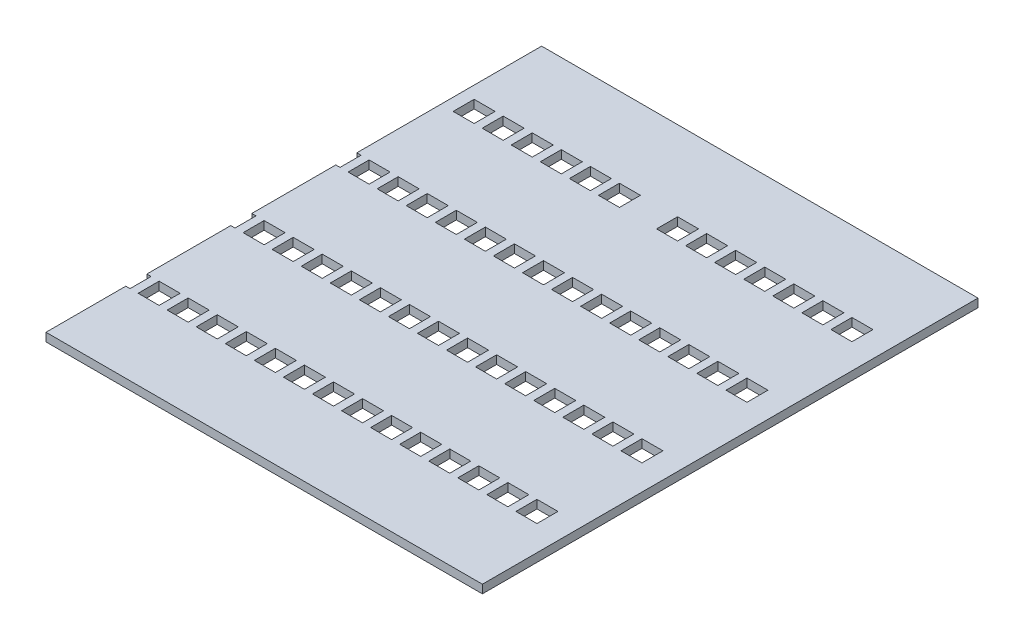
from build123d import *

# Parameters (mm, degrees)
SKETCH3_W           = 5
SKETCH3_H           = 5
BOSS_EXTRUDE1_DEPTH = 2


with BuildPart() as part:
    # Sketch3 → Boss-Extrude1 (new body)
    with BuildSketch(Plane(origin=(0, 0, 0), x_dir=(1, 0, 0), z_dir=(0, 1, 0))):
        Polygon((43.186764706, 63.988970588), (-60.713235294, 63.988970588), (-60.713235294, 19.988970588), (-59.703235294, 19.988970588), (-59.703235294, 14.988970588), (-60.713235294, 14.988970588), (-60.713235294, -5.011029412), (-59.703235294, -5.011029412), (-59.703235294, -10.011029412), (-60.713235294, -10.011029412), (-60.713235294, -30.011029412), (-59.703235294, -30.011029412), (-59.703235294, -35.011029412), (-60.713235294, -35.011029412), (-60.713235294, -54.011029412), (43.186764706, -54.011029412), align=None)
        with Locations((-55.283235294, -32.511029412)):
            Rectangle(SKETCH3_W, SKETCH3_H, mode=Mode.SUBTRACT)
        with Locations((-48.363235294, -32.511029412)):
            Rectangle(SKETCH3_W, SKETCH3_H, mode=Mode.SUBTRACT)
        with Locations((-41.443235294, -32.511029412)):
            Rectangle(SKETCH3_W, SKETCH3_H, mode=Mode.SUBTRACT)
        with Locations((-34.523235294, -32.511029412)):
            Rectangle(SKETCH3_W, SKETCH3_H, mode=Mode.SUBTRACT)
        with Locations((-27.603235294, -32.511029412)):
            Rectangle(SKETCH3_W, SKETCH3_H, mode=Mode.SUBTRACT)
        with Locations((-20.683235294, -32.511029412)):
            Rectangle(SKETCH3_W, SKETCH3_H, mode=Mode.SUBTRACT)
        with Locations((-13.763235294, -32.511029412)):
            Rectangle(SKETCH3_W, SKETCH3_H, mode=Mode.SUBTRACT)
        with Locations((-55.283235294, -7.511029412)):
            Rectangle(SKETCH3_W, SKETCH3_H, mode=Mode.SUBTRACT)
        with Locations((-48.363235294, -7.511029412)):
            Rectangle(SKETCH3_W, SKETCH3_H, mode=Mode.SUBTRACT)
        with Locations((-41.443235294, -7.511029412)):
            Rectangle(SKETCH3_W, SKETCH3_H, mode=Mode.SUBTRACT)
        with Locations((-34.523235294, -7.511029412)):
            Rectangle(SKETCH3_W, SKETCH3_H, mode=Mode.SUBTRACT)
        with Locations((-27.603235294, -7.511029412)):
            Rectangle(SKETCH3_W, SKETCH3_H, mode=Mode.SUBTRACT)
        with Locations((-20.683235294, -7.511029412)):
            Rectangle(SKETCH3_W, SKETCH3_H, mode=Mode.SUBTRACT)
        with Locations((-13.763235294, -7.511029412)):
            Rectangle(SKETCH3_W, SKETCH3_H, mode=Mode.SUBTRACT)
        with Locations((-6.843235294, -32.511029412)):
            Rectangle(SKETCH3_W, SKETCH3_H, mode=Mode.SUBTRACT)
        with Locations((0.076764706, -32.511029412)):
            Rectangle(SKETCH3_W, SKETCH3_H, mode=Mode.SUBTRACT)
        with Locations((6.996764706, -32.511029412)):
            Rectangle(SKETCH3_W, SKETCH3_H, mode=Mode.SUBTRACT)
        with Locations((13.916764706, -32.511029412)):
            Rectangle(SKETCH3_W, SKETCH3_H, mode=Mode.SUBTRACT)
        with Locations((20.836764706, -32.511029412)):
            Rectangle(SKETCH3_W, SKETCH3_H, mode=Mode.SUBTRACT)
        with Locations((27.756764706, -32.511029412)):
            Rectangle(SKETCH3_W, SKETCH3_H, mode=Mode.SUBTRACT)
        with Locations((34.676764706, -32.511029412)):
            Rectangle(SKETCH3_W, SKETCH3_H, mode=Mode.SUBTRACT)
        with Locations((-6.843235294, -7.511029412)):
            Rectangle(SKETCH3_W, SKETCH3_H, mode=Mode.SUBTRACT)
        with Locations((0.076764706, -7.511029412)):
            Rectangle(SKETCH3_W, SKETCH3_H, mode=Mode.SUBTRACT)
        with Locations((6.996764706, -7.511029412)):
            Rectangle(SKETCH3_W, SKETCH3_H, mode=Mode.SUBTRACT)
        with Locations((13.916764706, -7.511029412)):
            Rectangle(SKETCH3_W, SKETCH3_H, mode=Mode.SUBTRACT)
        with Locations((20.836764706, -7.511029412)):
            Rectangle(SKETCH3_W, SKETCH3_H, mode=Mode.SUBTRACT)
        with Locations((27.756764706, -7.511029412)):
            Rectangle(SKETCH3_W, SKETCH3_H, mode=Mode.SUBTRACT)
        with Locations((34.676764706, -7.511029412)):
            Rectangle(SKETCH3_W, SKETCH3_H, mode=Mode.SUBTRACT)
        with Locations((-55.283235294, 17.488970588)):
            Rectangle(SKETCH3_W, SKETCH3_H, mode=Mode.SUBTRACT)
        with Locations((-48.363235294, 17.488970588)):
            Rectangle(SKETCH3_W, SKETCH3_H, mode=Mode.SUBTRACT)
        with Locations((-41.443235294, 17.488970588)):
            Rectangle(SKETCH3_W, SKETCH3_H, mode=Mode.SUBTRACT)
        with Locations((-34.523235294, 17.488970588)):
            Rectangle(SKETCH3_W, SKETCH3_H, mode=Mode.SUBTRACT)
        with Locations((-27.603235294, 17.488970588)):
            Rectangle(SKETCH3_W, SKETCH3_H, mode=Mode.SUBTRACT)
        with Locations((-20.683235294, 17.488970588)):
            Rectangle(SKETCH3_W, SKETCH3_H, mode=Mode.SUBTRACT)
        with Locations((-13.763235294, 17.488970588)):
            Rectangle(SKETCH3_W, SKETCH3_H, mode=Mode.SUBTRACT)
        with Locations((-55.283235294, 42.488970588)):
            Rectangle(SKETCH3_W, SKETCH3_H, mode=Mode.SUBTRACT)
        with Locations((-48.363235294, 42.488970588)):
            Rectangle(SKETCH3_W, SKETCH3_H, mode=Mode.SUBTRACT)
        with Locations((-41.443235294, 42.488970588)):
            Rectangle(SKETCH3_W, SKETCH3_H, mode=Mode.SUBTRACT)
        with Locations((-34.523235294, 42.488970588)):
            Rectangle(SKETCH3_W, SKETCH3_H, mode=Mode.SUBTRACT)
        with Locations((-27.603235294, 42.488970588)):
            Rectangle(SKETCH3_W, SKETCH3_H, mode=Mode.SUBTRACT)
        with Locations((-20.683235294, 42.488970588)):
            Rectangle(SKETCH3_W, SKETCH3_H, mode=Mode.SUBTRACT)
        with Locations((-6.843235294, 17.488970588)):
            Rectangle(SKETCH3_W, SKETCH3_H, mode=Mode.SUBTRACT)
        with Locations((0.076764706, 17.488970588)):
            Rectangle(SKETCH3_W, SKETCH3_H, mode=Mode.SUBTRACT)
        with Locations((6.996764706, 17.488970588)):
            Rectangle(SKETCH3_W, SKETCH3_H, mode=Mode.SUBTRACT)
        with Locations((13.916764706, 17.488970588)):
            Rectangle(SKETCH3_W, SKETCH3_H, mode=Mode.SUBTRACT)
        with Locations((20.836764706, 17.488970588)):
            Rectangle(SKETCH3_W, SKETCH3_H, mode=Mode.SUBTRACT)
        with Locations((27.756764706, 17.488970588)):
            Rectangle(SKETCH3_W, SKETCH3_H, mode=Mode.SUBTRACT)
        with Locations((34.676764706, 17.488970588)):
            Rectangle(SKETCH3_W, SKETCH3_H, mode=Mode.SUBTRACT)
        with Locations((-6.843235294, 42.488970588)):
            Rectangle(SKETCH3_W, SKETCH3_H, mode=Mode.SUBTRACT)
        with Locations((0.076764706, 42.488970588)):
            Rectangle(SKETCH3_W, SKETCH3_H, mode=Mode.SUBTRACT)
        with Locations((6.996764706, 42.488970588)):
            Rectangle(SKETCH3_W, SKETCH3_H, mode=Mode.SUBTRACT)
        with Locations((13.916764706, 42.488970588)):
            Rectangle(SKETCH3_W, SKETCH3_H, mode=Mode.SUBTRACT)
        with Locations((20.836764706, 42.488970588)):
            Rectangle(SKETCH3_W, SKETCH3_H, mode=Mode.SUBTRACT)
        with Locations((27.756764706, 42.488970588)):
            Rectangle(SKETCH3_W, SKETCH3_H, mode=Mode.SUBTRACT)
        with Locations((34.676764706, 42.488970588)):
            Rectangle(SKETCH3_W, SKETCH3_H, mode=Mode.SUBTRACT)
    extrude(amount=BOSS_EXTRUDE1_DEPTH)


solid = part.part
